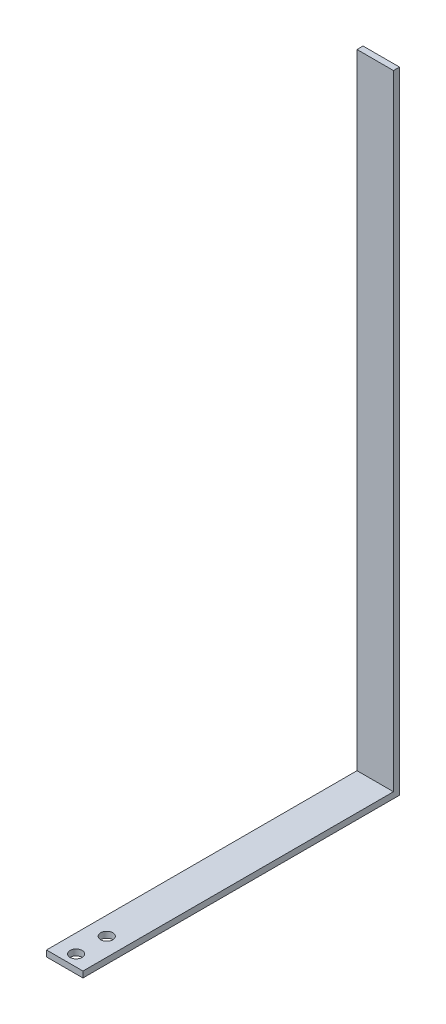
from build123d import *

# Parameters (mm, degrees)
CROQUIS1_W              = 38.1
CROQUIS1_H              = 6.31
SALIENTE_EXTRUIR1_DEPTH = 330.7
CROQUIS3_W              = 38.1
CROQUIS3_H              = 6.31
SALIENTE_EXTRUIR2_DEPTH = 658.79
CROQUIS4_R              = 6.35
CORTAR_EXTRUIR1_DEPTH   = 6.31


with BuildPart() as part:
    # Croquis1 → Saliente-Extruir1 (new body)
    with BuildSketch(Plane.XY):
        Rectangle(CROQUIS1_W, CROQUIS1_H)
    extrude(amount=SALIENTE_EXTRUIR1_DEPTH)

    # Croquis3 → Saliente-Extruir2 (add)
    with BuildSketch(Plane.XZ.offset(3.155)):
        with Locations((0, 3.155)):
            Rectangle(CROQUIS3_W, CROQUIS3_H)
    extrude(amount=-SALIENTE_EXTRUIR2_DEPTH)

    # Croquis4 → Cortar-Extruir1 (cut)
    with BuildSketch(Plane(origin=(0, -3.155, 0), x_dir=(-1, 0, 0), z_dir=(0, -1, 0))):
        with Locations(Location((0, -286.807795334, 0), (0, 0, 90))):
            Circle(CROQUIS4_R)
        with Locations(Location((0, -318.807795334, 0), (0, 0, 90))):
            Circle(CROQUIS4_R)
    extrude(amount=-CORTAR_EXTRUIR1_DEPTH, mode=Mode.SUBTRACT)


solid = part.part
